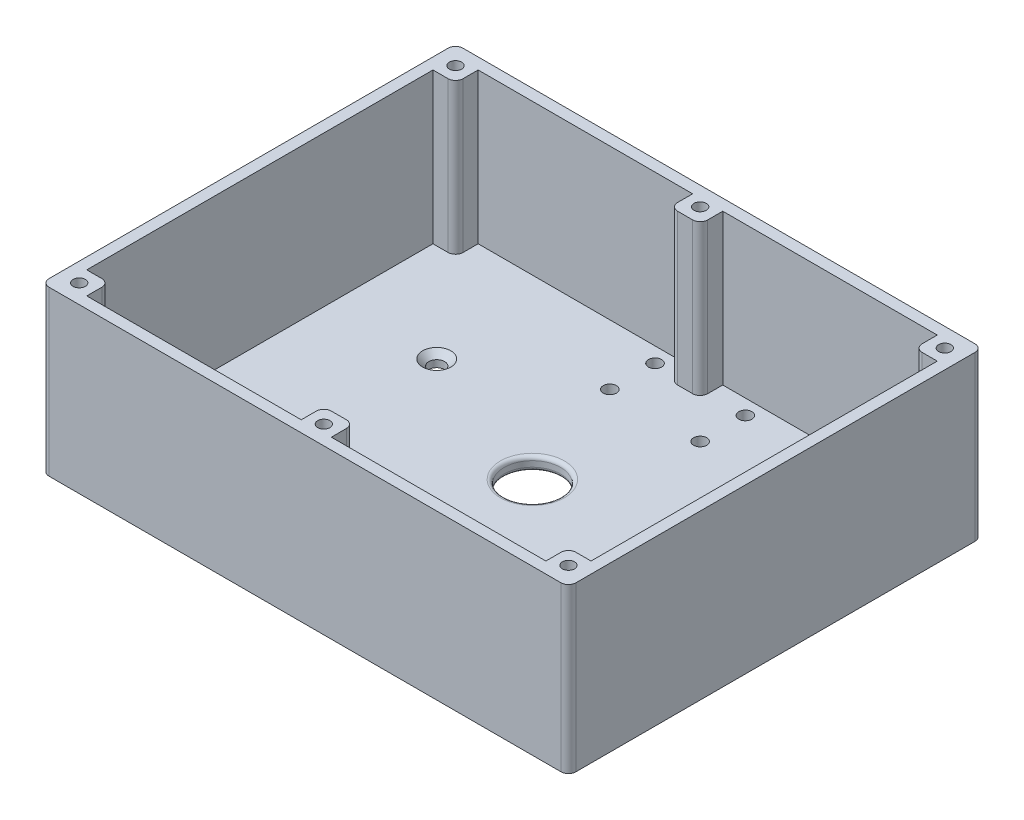
from build123d import *

# Parameters (mm, degrees)
SKETCH1_W                             = 140
SKETCH1_H                             = 110
BOTTOM_DEPTH                          = 3.5
SKETCH3_W                             = 140
SKETCH3_H                             = 110
WALL_DEPTH                            = 40
SKETCH4_R                             = 1.625
TOP_PLATE_SCREW_HOLES_DEPTH           = 30
TOP_PLATE_SCREW_HOLES_DRAFT           = -1
TOP_PLATE_SCREW_HOLES_PROFILE_2_DEPTH = 30
TOP_PLATE_SCREW_HOLES_PROFILE_2_DRAFT = -1
TOP_PLATE_SCREW_HOLES_PROFILE_3_DEPTH = 30
TOP_PLATE_SCREW_HOLES_PROFILE_3_DRAFT = -1
TOP_PLATE_SCREW_HOLES_PROFILE_4_DEPTH = 30
TOP_PLATE_SCREW_HOLES_PROFILE_4_DRAFT = -1
TOP_PLATE_SCREW_HOLES_PROFILE_5_DEPTH = 30
TOP_PLATE_SCREW_HOLES_PROFILE_5_DRAFT = -1
TOP_PLATE_SCREW_HOLES_PROFILE_6_DEPTH = 30
TOP_PLATE_SCREW_HOLES_PROFILE_6_DRAFT = -1
FILLET14_R                            = 2
FILLET13_R                            = 2
FILLET12_R                            = 2
FILLET11_R                            = 2
FILLET1_R                             = 2
FILLET2_R                             = 2
FILLET3_R                             = 2
FILLET4_R                             = 2
FILLET5_R                             = 2
FILLET6_R                             = 2
FILLET7_R                             = 2
FILLET8_R                             = 2
M4_MOUNT_R                            = 2.1
M4_MOUNT_CUT_DEPTH                    = 98.59610648
SKETCH7_R                             = 7.5
USB_CABEL_CUT_DEPTH                   = 100.082036717
FILLET9_R                             = 1
FILLET10_R                            = 1
SKETCH8_R                             = 1.75
CUT_EXTRUDE4_DEPTH                    = 10


with BuildPart() as part:
    # Sketch1 → Bottom (new body)
    with BuildSketch(Plane(origin=(0, 0, 0), x_dir=(1, 0, 0), z_dir=(0, 1, 0))):
        Rectangle(SKETCH1_W, SKETCH1_H)
    extrude(amount=BOTTOM_DEPTH)

    # Sketch3 → Wall (add)
    with BuildSketch(Plane(origin=(0, 3.5, 0), x_dir=(1, 0, 0), z_dir=(0, 1, 0))):
        Rectangle(SKETCH3_W, SKETCH3_H)
        Polygon((-61, 52), (-4, 52), (-4, 46), (4, 46), (4, 52), (61, 52), (61, 46), (67, 46), (67, -46), (61, -46), (61, -52), (4, -52), (4, -46), (-4, -46), (-4, -52), (-61, -52), (-61, -46), (-67, -46), (-67, 46), (-61, 46), align=None, mode=Mode.SUBTRACT)
    extrude(amount=WALL_DEPTH)


with BuildPart() as top_plate_screw_holes_tool:
    # Sketch4 → Top Plate Screw Holes (with draft: the straight prism first)
    with BuildSketch(Plane(origin=(0, 43.5, 0), x_dir=(1, 0, 0), z_dir=(0, 1, 0))):
        with Locations((-65, 50)):
            Circle(SKETCH4_R)
    extrude(amount=-TOP_PLATE_SCREW_HOLES_DEPTH)
    # Top Plate Screw Holes: the draft: its side faces are tilted about the plane it starts from
    top_plate_screw_holes_sides = [top_plate_screw_holes_tool.faces().sort_by_distance(p)[0] for p in [
        (-66.625, 28.5, -50),
    ]]
    draft(top_plate_screw_holes_sides, Plane(origin=(0, 43.5, 0), x_dir=(1, 0, 0), z_dir=(0, 1, 0)), TOP_PLATE_SCREW_HOLES_DRAFT)


with BuildPart() as part_1:
    add(part.part)

    # Top Plate Screw Holes: cut by top_plate_screw_holes_tool
    add(top_plate_screw_holes_tool.part, mode=Mode.SUBTRACT)


with BuildPart() as top_plate_screw_holes_profile_2_tool:
    # Sketch4 → Top Plate Screw Holes profile 2 (with draft: the straight prism first)
    with BuildSketch(Plane(origin=(0, 43.5, 0), x_dir=(1, 0, 0), z_dir=(0, 1, 0))):
        with Locations((65, 50)):
            Circle(SKETCH4_R)
    extrude(amount=-TOP_PLATE_SCREW_HOLES_PROFILE_2_DEPTH)
    # Top Plate Screw Holes profile 2: the draft: its side faces are tilted about the plane it starts from
    top_plate_screw_holes_profile_2_sides = [top_plate_screw_holes_profile_2_tool.faces().sort_by_distance(p)[0] for p in [
        (63.375, 28.5, -50),
    ]]
    draft(top_plate_screw_holes_profile_2_sides, Plane(origin=(0, 43.5, 0), x_dir=(1, 0, 0), z_dir=(0, 1, 0)), TOP_PLATE_SCREW_HOLES_PROFILE_2_DRAFT)


with BuildPart() as part_2:
    add(part_1.part)

    # Top Plate Screw Holes profile 2: cut by top_plate_screw_holes_profile_2_tool
    add(top_plate_screw_holes_profile_2_tool.part, mode=Mode.SUBTRACT)


with BuildPart() as top_plate_screw_holes_profile_3_tool:
    # Sketch4 → Top Plate Screw Holes profile 3 (with draft: the straight prism first)
    with BuildSketch(Plane(origin=(0, 43.5, 0), x_dir=(1, 0, 0), z_dir=(0, 1, 0))):
        with Locations((65, -50)):
            Circle(SKETCH4_R)
    extrude(amount=-TOP_PLATE_SCREW_HOLES_PROFILE_3_DEPTH)
    # Top Plate Screw Holes profile 3: the draft: its side faces are tilted about the plane it starts from
    top_plate_screw_holes_profile_3_sides = [top_plate_screw_holes_profile_3_tool.faces().sort_by_distance(p)[0] for p in [
        (63.375, 28.5, 50),
    ]]
    draft(top_plate_screw_holes_profile_3_sides, Plane(origin=(0, 43.5, 0), x_dir=(1, 0, 0), z_dir=(0, 1, 0)), TOP_PLATE_SCREW_HOLES_PROFILE_3_DRAFT)


with BuildPart() as part_3:
    add(part_2.part)

    # Top Plate Screw Holes profile 3: cut by top_plate_screw_holes_profile_3_tool
    add(top_plate_screw_holes_profile_3_tool.part, mode=Mode.SUBTRACT)


with BuildPart() as top_plate_screw_holes_profile_4_tool:
    # Sketch4 → Top Plate Screw Holes profile 4 (with draft: the straight prism first)
    with BuildSketch(Plane(origin=(0, 43.5, 0), x_dir=(1, 0, 0), z_dir=(0, 1, 0))):
        with Locations((-65, -50)):
            Circle(SKETCH4_R)
    extrude(amount=-TOP_PLATE_SCREW_HOLES_PROFILE_4_DEPTH)
    # Top Plate Screw Holes profile 4: the draft: its side faces are tilted about the plane it starts from
    top_plate_screw_holes_profile_4_sides = [top_plate_screw_holes_profile_4_tool.faces().sort_by_distance(p)[0] for p in [
        (-66.625, 28.5, 50),
    ]]
    draft(top_plate_screw_holes_profile_4_sides, Plane(origin=(0, 43.5, 0), x_dir=(1, 0, 0), z_dir=(0, 1, 0)), TOP_PLATE_SCREW_HOLES_PROFILE_4_DRAFT)


with BuildPart() as part_4:
    add(part_3.part)

    # Top Plate Screw Holes profile 4: cut by top_plate_screw_holes_profile_4_tool
    add(top_plate_screw_holes_profile_4_tool.part, mode=Mode.SUBTRACT)


with BuildPart() as top_plate_screw_holes_profile_5_tool:
    # Sketch4 → Top Plate Screw Holes profile 5 (with draft: the straight prism first)
    with BuildSketch(Plane(origin=(0, 43.5, 0), x_dir=(1, 0, 0), z_dir=(0, 1, 0))):
        with Locations((0, 50)):
            Circle(SKETCH4_R)
    extrude(amount=-TOP_PLATE_SCREW_HOLES_PROFILE_5_DEPTH)
    # Top Plate Screw Holes profile 5: the draft: its side faces are tilted about the plane it starts from
    top_plate_screw_holes_profile_5_sides = [top_plate_screw_holes_profile_5_tool.faces().sort_by_distance(p)[0] for p in [
        (-1.625, 28.5, -50),
    ]]
    draft(top_plate_screw_holes_profile_5_sides, Plane(origin=(0, 43.5, 0), x_dir=(1, 0, 0), z_dir=(0, 1, 0)), TOP_PLATE_SCREW_HOLES_PROFILE_5_DRAFT)


with BuildPart() as part_5:
    add(part_4.part)

    # Top Plate Screw Holes profile 5: cut by top_plate_screw_holes_profile_5_tool
    add(top_plate_screw_holes_profile_5_tool.part, mode=Mode.SUBTRACT)


with BuildPart() as top_plate_screw_holes_profile_6_tool:
    # Sketch4 → Top Plate Screw Holes profile 6 (with draft: the straight prism first)
    with BuildSketch(Plane(origin=(0, 43.5, 0), x_dir=(1, 0, 0), z_dir=(0, 1, 0))):
        with Locations((0, -50)):
            Circle(SKETCH4_R)
    extrude(amount=-TOP_PLATE_SCREW_HOLES_PROFILE_6_DEPTH)
    # Top Plate Screw Holes profile 6: the draft: its side faces are tilted about the plane it starts from
    top_plate_screw_holes_profile_6_sides = [top_plate_screw_holes_profile_6_tool.faces().sort_by_distance(p)[0] for p in [
        (-1.625, 28.5, 50),
    ]]
    draft(top_plate_screw_holes_profile_6_sides, Plane(origin=(0, 43.5, 0), x_dir=(1, 0, 0), z_dir=(0, 1, 0)), TOP_PLATE_SCREW_HOLES_PROFILE_6_DRAFT)


with BuildPart() as part_6:
    add(part_5.part)

    # Top Plate Screw Holes profile 6: cut by top_plate_screw_holes_profile_6_tool
    add(top_plate_screw_holes_profile_6_tool.part, mode=Mode.SUBTRACT)

    # Fillet14
    fillet14_edges = [part_6.edges().sort_by_distance(p)[0] for p in [
        (-4, 23.5, 46),
    ]]
    fillet(fillet14_edges, radius=FILLET14_R)

    # Fillet13
    fillet13_edges = [part_6.edges().sort_by_distance(p)[0] for p in [
        (4, 23.5, 46),
    ]]
    fillet(fillet13_edges, radius=FILLET13_R)

    # Fillet12
    fillet12_edges = [part_6.edges().sort_by_distance(p)[0] for p in [
        (-4, 23.5, -46),
    ]]
    fillet(fillet12_edges, radius=FILLET12_R)

    # Fillet11
    fillet11_edges = [part_6.edges().sort_by_distance(p)[0] for p in [
        (4, 23.5, -46),
    ]]
    fillet(fillet11_edges, radius=FILLET11_R)

    # Fillet1
    fillet1_edges = [part_6.edges().sort_by_distance(p)[0] for p in [
        (-61, 23.5, 46),
    ]]
    fillet(fillet1_edges, radius=FILLET1_R)

    # Fillet2
    fillet2_edges = [part_6.edges().sort_by_distance(p)[0] for p in [
        (61, 23.5, 46),
    ]]
    fillet(fillet2_edges, radius=FILLET2_R)

    # Fillet3
    fillet3_edges = [part_6.edges().sort_by_distance(p)[0] for p in [
        (61, 23.5, -46),
    ]]
    fillet(fillet3_edges, radius=FILLET3_R)

    # Fillet4
    fillet4_edges = [part_6.edges().sort_by_distance(p)[0] for p in [
        (-61, 23.5, -46),
    ]]
    fillet(fillet4_edges, radius=FILLET4_R)

    # Fillet5
    fillet5_edges = [part_6.edges().sort_by_distance(p)[0] for p in [
        (-70, 21.75, -55),
    ]]
    fillet(fillet5_edges, radius=FILLET5_R)

    # Fillet6
    fillet6_edges = [part_6.edges().sort_by_distance(p)[0] for p in [
        (70, 21.75, -55),
    ]]
    fillet(fillet6_edges, radius=FILLET6_R)

    # Fillet7
    fillet7_edges = [part_6.edges().sort_by_distance(p)[0] for p in [
        (70, 21.75, 55),
    ]]
    fillet(fillet7_edges, radius=FILLET7_R)

    # Fillet8
    fillet8_edges = [part_6.edges().sort_by_distance(p)[0] for p in [
        (-70, 21.75, 55),
    ]]
    fillet(fillet8_edges, radius=FILLET8_R)

    # M4 Mount → M4 Mount Cut (cut, through all)
    with BuildSketch(Plane.XZ.offset(-3.5)):
        with Locations(Location((40, -20, 0), (0, 0, 270))):
            Circle(M4_MOUNT_R)
        with Locations(Location((40, 20, 0), (0, 0, 270))):
            Circle(M4_MOUNT_R)
        with Locations(Location((-40, 20, 0), (0, 0, 90))):
            Circle(M4_MOUNT_R)
        with Locations(Location((-40, -20, 0), (0, 0, 90))):
            Circle(M4_MOUNT_R)
    extrude(amount=M4_MOUNT_CUT_DEPTH, mode=Mode.SUBTRACT)

    # Cut-Extrude3 cone 1 section (through the dimple's axis) → Cut-Extrude3 (revolve, cut)
    with BuildSketch(Plane(origin=(40, 3.5, 20), x_dir=(0, 0, 1), z_dir=(1, 0, 0))):
        Polygon((0, 0), (3.75, 0), (0, 3.75), align=None)
    revolve(axis=Axis((40, 3.5, 20), (0, -1, 0)), mode=Mode.SUBTRACT)

    # Cut-Extrude3 cone 2 section (through the dimple's axis) → Cut-Extrude3 cone 2 (revolve, cut)
    with BuildSketch(Plane(origin=(40, 3.5, -20), x_dir=(0, 0, 1), z_dir=(1, 0, 0))):
        Polygon((0, 0), (3.75, 0), (0, 3.75), align=None)
    revolve(axis=Axis((40, 3.5, -20), (0, -1, 0)), mode=Mode.SUBTRACT)

    # Cut-Extrude3 cone 3 section (through the dimple's axis) → Cut-Extrude3 cone 3 (revolve, cut)
    with BuildSketch(Plane(origin=(-40, 3.5, -20), x_dir=(0, 0, 1), z_dir=(1, 0, 0))):
        Polygon((0, 0), (3.75, 0), (0, 3.75), align=None)
    revolve(axis=Axis((-40, 3.5, -20), (0, -1, 0)), mode=Mode.SUBTRACT)

    # Cut-Extrude3 cone 4 section (through the dimple's axis) → Cut-Extrude3 cone 4 (revolve, cut)
    with BuildSketch(Plane(origin=(-40, 3.5, 20), x_dir=(0, 0, 1), z_dir=(1, 0, 0))):
        Polygon((0, 0), (3.75, 0), (0, 3.75), align=None)
    revolve(axis=Axis((-40, 3.5, 20), (0, -1, 0)), mode=Mode.SUBTRACT)

    # Sketch7 → USB Cabel Cut (cut, through all)
    with BuildSketch(Plane.XZ):
        with Locations(Location((0.418373374, -5, 0), (0, 0, 270))):
            Circle(SKETCH7_R)
    extrude(amount=-USB_CABEL_CUT_DEPTH, mode=Mode.SUBTRACT)

    # Fillet9
    fillet9_edges = [part_6.edges().sort_by_distance(p)[0] for p in [
        (0.418373374, 0, 2.5),
    ]]
    fillet(fillet9_edges, radius=FILLET9_R)

    # Fillet10
    fillet10_edges = [part_6.edges().sort_by_distance(p)[0] for p in [
        (0.418373374, 3.5, 2.5),
    ]]
    fillet(fillet10_edges, radius=FILLET10_R)

    # Sketch8 → Cut-Extrude4 (cut)
    with BuildSketch(Plane(origin=(0, 3.5, 0), x_dir=(1, 0, 0), z_dir=(0, 1, 0))):
        with Locations(Location((-10, 48, 0), (0, 0, 270))):
            Circle(SKETCH8_R)
        with Locations(Location((-10, 36, 0), (0, 0, 270))):
            Circle(SKETCH8_R)
        with Locations(Location((14, 48, 0), (0, 0, 270))):
            Circle(SKETCH8_R)
        with Locations(Location((14, 36, 0), (0, 0, 270))):
            Circle(SKETCH8_R)
    extrude(amount=-CUT_EXTRUDE4_DEPTH, mode=Mode.SUBTRACT)


solid = part_6.part
